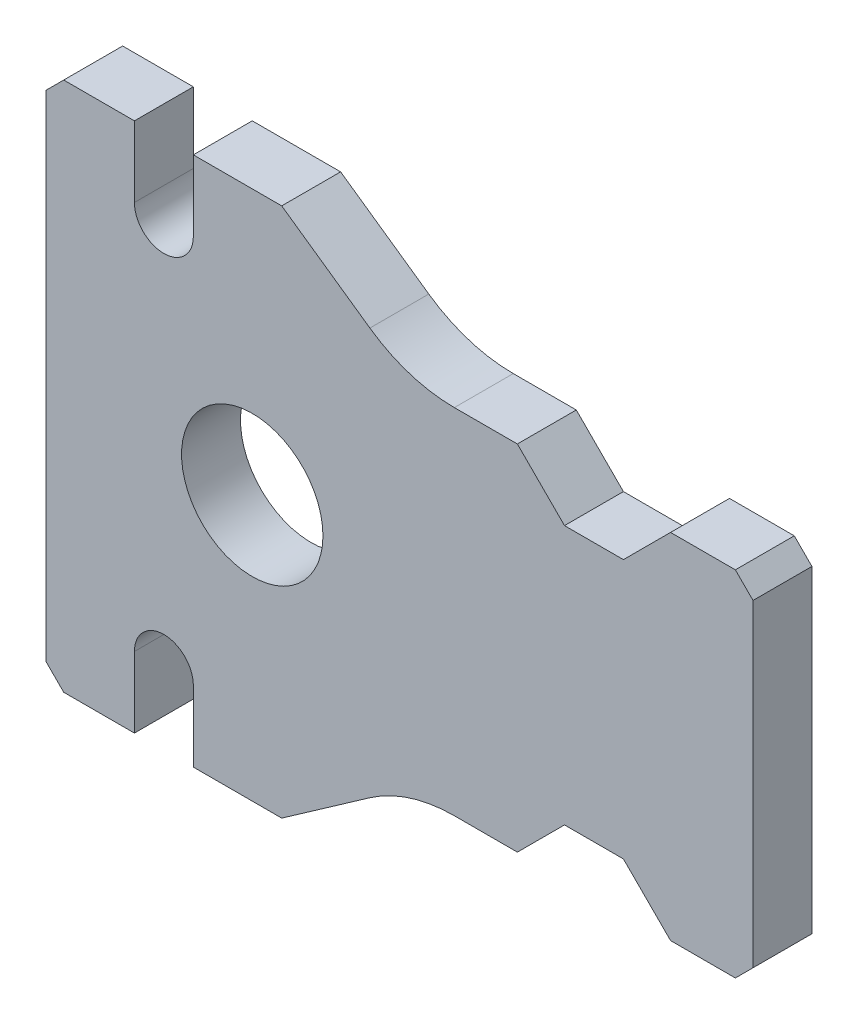
from build123d import *

# Parameters (mm, degrees)
SKETCH1_R           = 12
BOSS_EXTRUDE1_DEPTH = 10
CHAMFER1_SIZE       = 3


with BuildPart() as part:
    # Sketch1 → Boss-Extrude1 (new body)
    with BuildSketch(Plane.XY):
        with BuildLine():
            Line((-35, 42), (-35, -42))
            Line((-35, -42), (-32, -45))
            Line((-32, -45), (-20, -45))
            Line((-20, -45), (-20, -33))
            ThreePointArc((-20, -33), (-15, -28), (-10, -33))
            Line((-10, -33), (-10, -45))
            Line((-10, -45), (5, -45))
            Line((5, -45), (19.965278914, -34.521198893))
            ThreePointArc((19.965278914, -34.521198893), (26.787044835, -31.157076231), (34.304689823, -30))
            Line((34.304689823, -30), (45, -30))
            Line((45, -30), (53, -22))
            Line((53, -22), (63, -22))
            Line((63, -22), (71, -30))
            Line((71, -30), (85, -30))
            Line((85, -30), (85, 30))
            Line((85, 30), (71, 30))
            Line((71, 30), (63, 22))
            Line((63, 22), (53, 22))
            Line((53, 22), (45, 30))
            Line((45, 30), (34.304689823, 30))
            ThreePointArc((34.304689823, 30), (26.787044835, 31.157076231), (19.965278914, 34.521198893))
            Line((19.965278914, 34.521198893), (5, 45))
            Line((5, 45), (-10, 45))
            Line((-10, 45), (-10, 33))
            ThreePointArc((-10, 33), (-15, 28), (-20, 33))
            Line((-20, 33), (-20, 45))
            Line((-20, 45), (-32, 45))
            Line((-32, 45), (-35, 42))
        make_face()
        Circle(SKETCH1_R, mode=Mode.SUBTRACT)
    extrude(amount=BOSS_EXTRUDE1_DEPTH)

    # Chamfer1
    chamfer1_edges = [part.edges().sort_by_distance(p)[0] for p in [
        (85, 30, 5),
        (85, -30, 5),
    ]]
    chamfer(chamfer1_edges, length=CHAMFER1_SIZE)


solid = part.part
